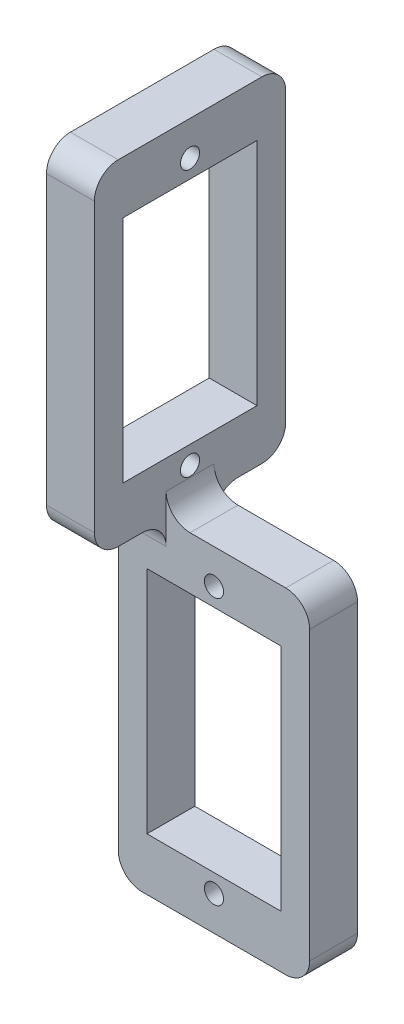
from build123d import *

# Parameters (mm, degrees)
SKETCH1_W           = 20
SKETCH1_H           = 35
SKETCH1_W_2         = 14
SKETCH1_H_2         = 24
BOSS_EXTRUDE1_DEPTH = 5
SKETCH2_R           = 1
CUT_EXTRUDE1_DEPTH  = 5
BOSS_EXTRUDE2_DEPTH = 5
FILLET1_R           = 2.5
FILLET2_R           = 2.5
SKETCH5_R           = 1
SKETCH5_W           = 14
SKETCH5_H           = 24
CUT_EXTRUDE2_DEPTH  = 10


with BuildPart() as part:
    # Sketch1 → Boss-Extrude1 (new body)
    with BuildSketch(Plane.XY):
        Rectangle(SKETCH1_W, SKETCH1_H)
        Rectangle(SKETCH1_W_2, SKETCH1_H_2, mode=Mode.SUBTRACT)
    extrude(amount=BOSS_EXTRUDE1_DEPTH)

    # Sketch2 → Cut-Extrude1 (cut)
    with BuildSketch(Plane.XY.offset(5)):
        with Locations((0, 13.9)):
            Circle(SKETCH2_R)
        with Locations(Location((0, -13.9, 0), (0, 0, 180))):
            Circle(SKETCH2_R)
    extrude(amount=-CUT_EXTRUDE1_DEPTH, mode=Mode.SUBTRACT)

    # Sketch3 → Boss-Extrude2 (add)
    with BuildSketch(Plane.ZY.offset(10)):
        Polygon((-7.5, 52.5), (-7.5, 17.5), (0, 17.5), (2.5, 17.5), (2.5, 52.5), align=None)
        Polygon((2.5, 52.5), (2.5, 17.5), (5, 17.5), (12.5, 17.5), (12.5, 52.5), align=None)
    extrude(amount=-BOSS_EXTRUDE2_DEPTH)

    # Fillet1
    fillet1_edges = [part.edges().sort_by_distance(p)[0] for p in [
        (-7.5, 17.5, 0),
        (-7.5, 17.5, 5),
    ]]
    fillet(fillet1_edges, radius=FILLET1_R)

    # Fillet2
    fillet2_edges = [part.edges().sort_by_distance(p)[0] for p in [
        (-5, 17.5, 2.5),
        (-7.5, 17.5, 12.5),
        (-7.5, 17.5, -7.5),
        (-7.5, 52.5, -7.5),
        (-7.5, 52.5, 12.5),
        (10, -17.5, 2.5),
        (-10, -17.5, 2.5),
        (10, 17.5, 2.5),
    ]]
    fillet(fillet2_edges, radius=FILLET2_R)

    # Sketch5 → Cut-Extrude2 (cut)
    with BuildSketch(Plane(origin=(-5, 0, 0), x_dir=(0, 0, -1), z_dir=(1, 0, 0))):
        with Locations((-2.5, 21.1)):
            Circle(SKETCH5_R)
        with Locations((-2.5, 48.9)):
            Circle(SKETCH5_R)
        with Locations((-2.5, 35)):
            Rectangle(SKETCH5_W, SKETCH5_H)
    extrude(amount=-CUT_EXTRUDE2_DEPTH, mode=Mode.SUBTRACT)


solid = part.part
